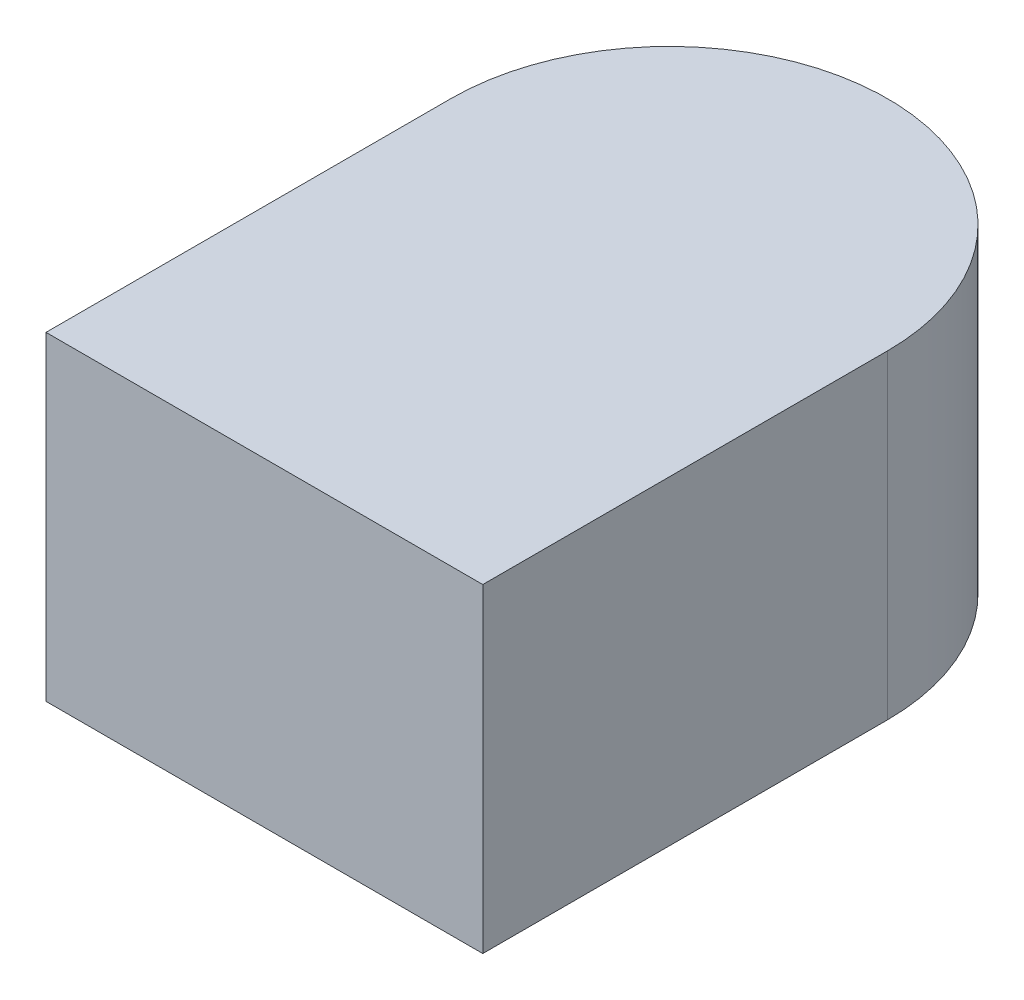
from build123d import *

# Parameters (mm, degrees)
BOSS_EXTRUDE1_DEPTH = 30
FILLET1_R           = 0.5


with BuildPart() as part:
    # Sketch2 → Boss-Extrude1 (new body)
    with BuildSketch(Plane(origin=(0, 0, 0), x_dir=(1, 0, 0), z_dir=(0, 1, 0))):
        with BuildLine():
            ThreePointArc((38, 35), (17.5, 55.5), (-3, 35))
            Line((-3, 35), (-3, -3))
            Line((-3, -3), (38, -3))
            Line((38, -3), (38, 35))
        make_face()
    extrude(amount=BOSS_EXTRUDE1_DEPTH)

    # Sketch2<9> → Cut-Loft1 section 0
    with BuildSketch(Plane(origin=(0, 0, 0), x_dir=(1, 0, 0), z_dir=(0, 1, 0))):
        with BuildLine():
            Line((0, 0), (0, 35))
            ThreePointArc((0, 35), (17.5, 52.5), (35, 35))
            Line((35, 35), (35, 0))
            Line((35, 0), (0, 0))
        make_face()
    # Sketch3 → Cut-Loft1 section 1
    with BuildSketch(Plane(origin=(0, 3.02, 0), x_dir=(-1, 0, 0), z_dir=(0, -1, 0))):
        with BuildLine():
            Line((-33.75, 1.5), (-1.25, 1.5))
            Line((-1.25, 1.5), (-1.25, 35))
            ThreePointArc((-1.25, 35), (-17.5, 51.25), (-33.75, 35))
            Line((-33.75, 35), (-33.75, 1.5))
        make_face()
    loft(mode=Mode.SUBTRACT)

    # Fillet1
    fillet1_edges = [part.edges().sort_by_distance(p)[0] for p in [
        (1.25, 3.02, -18.25),
        (33.75, 3.02, -18.25),
        (17.5, 3.02, -1.5),
        (17.5, 3.02, -51.25),
    ]]
    fillet(fillet1_edges, radius=FILLET1_R)


solid = part.part
